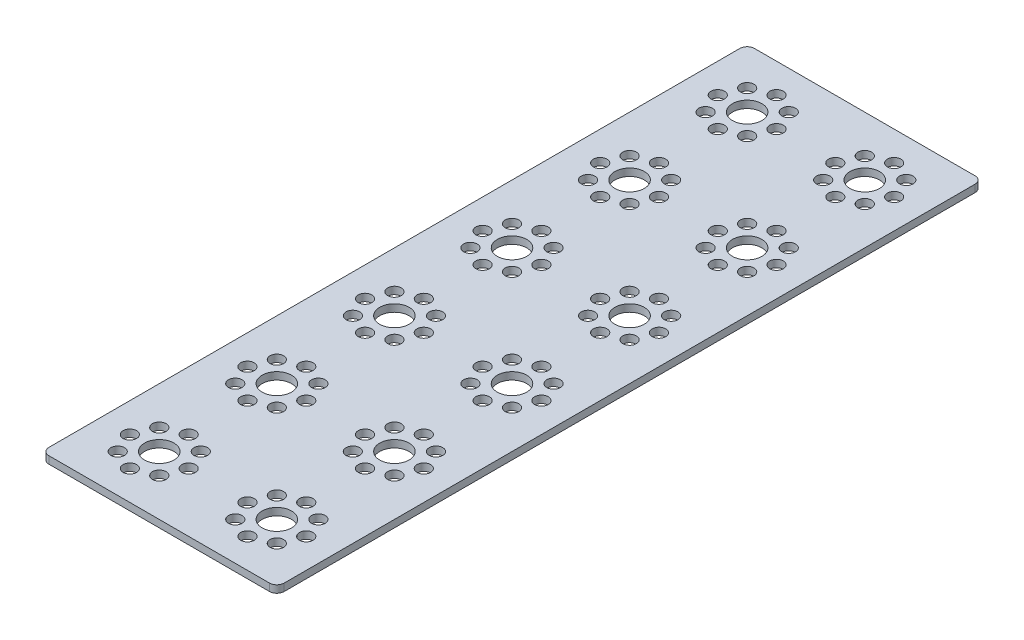
from build123d import *

# Parameters (mm, degrees)
SKETCH1_R           = 1.85
SKETCH1_R_2         = 4
BOSS_EXTRUDE1_DEPTH = 2


with BuildPart() as part:
    # Sketch1 → Boss-Extrude1 (new body)
    with BuildSketch(Plane.XZ):
        with BuildLine():
            Line((48, -174), (48, 14))
            ThreePointArc((48, 14), (47.414213562, 15.414213562), (46, 16))
            Line((46, 16), (-14, 16))
            ThreePointArc((-14, 16), (-15.414213562, 15.414213562), (-16, 14))
            Line((-16, 14), (-16, -174))
            ThreePointArc((-16, -174), (-15.414213562, -175.414213562), (-14, -176))
            Line((-14, -176), (46, -176))
            ThreePointArc((46, -176), (47.414213562, -175.414213562), (48, -174))
        make_face()
        with Locations(Location((37.656854249, -154.343145751, 0), (0, 0, 90))):
            Circle(SKETCH1_R, mode=Mode.SUBTRACT)
        with Locations(Location((26.343145751, -154.343145751, 0), (0, 0, 90))):
            Circle(SKETCH1_R, mode=Mode.SUBTRACT)
        with Locations(Location((26.343145751, -165.656854249, 0), (0, 0, 90))):
            Circle(SKETCH1_R, mode=Mode.SUBTRACT)
        with Locations(Location((37.656854249, -165.656854249, 0), (0, 0, 90))):
            Circle(SKETCH1_R, mode=Mode.SUBTRACT)
        with Locations(Location((24, -160, 0), (0, 0, 90))):
            Circle(SKETCH1_R, mode=Mode.SUBTRACT)
        with Locations(Location((32, -152, 0), (0, 0, 90))):
            Circle(SKETCH1_R, mode=Mode.SUBTRACT)
        with Locations(Location((40, -160, 0), (0, 0, 90))):
            Circle(SKETCH1_R, mode=Mode.SUBTRACT)
        with Locations(Location((32, -168, 0), (0, 0, 90))):
            Circle(SKETCH1_R, mode=Mode.SUBTRACT)
        with Locations(Location((32, -160, 0), (0, 0, 90))):
            Circle(SKETCH1_R_2, mode=Mode.SUBTRACT)
        with Locations(Location((5.656854249, -154.343145751, 0), (0, 0, 90))):
            Circle(SKETCH1_R, mode=Mode.SUBTRACT)
        with Locations(Location((-5.656854249, -154.343145751, 0), (0, 0, 90))):
            Circle(SKETCH1_R, mode=Mode.SUBTRACT)
        with Locations(Location((-5.656854249, -165.656854249, 0), (0, 0, 90))):
            Circle(SKETCH1_R, mode=Mode.SUBTRACT)
        with Locations(Location((5.656854249, -165.656854249, 0), (0, 0, 90))):
            Circle(SKETCH1_R, mode=Mode.SUBTRACT)
        with Locations(Location((-8, -160, 0), (0, 0, 90))):
            Circle(SKETCH1_R, mode=Mode.SUBTRACT)
        with Locations(Location((0, -152, 0), (0, 0, 90))):
            Circle(SKETCH1_R, mode=Mode.SUBTRACT)
        with Locations(Location((8, -160, 0), (0, 0, 90))):
            Circle(SKETCH1_R, mode=Mode.SUBTRACT)
        with Locations(Location((0, -168, 0), (0, 0, 90))):
            Circle(SKETCH1_R, mode=Mode.SUBTRACT)
        with Locations(Location((0, -160, 0), (0, 0, 90))):
            Circle(SKETCH1_R_2, mode=Mode.SUBTRACT)
        with Locations(Location((37.656854249, -122.34314575, 0), (0, 0, 90))):
            Circle(SKETCH1_R, mode=Mode.SUBTRACT)
        with Locations(Location((26.343145751, -122.34314575, 0), (0, 0, 90))):
            Circle(SKETCH1_R, mode=Mode.SUBTRACT)
        with Locations(Location((26.343145751, -133.656854249, 0), (0, 0, 90))):
            Circle(SKETCH1_R, mode=Mode.SUBTRACT)
        with Locations(Location((37.656854249, -133.656854249, 0), (0, 0, 90))):
            Circle(SKETCH1_R, mode=Mode.SUBTRACT)
        with Locations(Location((24, -128, 0), (0, 0, 90))):
            Circle(SKETCH1_R, mode=Mode.SUBTRACT)
        with Locations(Location((32, -120, 0), (0, 0, 90))):
            Circle(SKETCH1_R, mode=Mode.SUBTRACT)
        with Locations(Location((40, -128, 0), (0, 0, 90))):
            Circle(SKETCH1_R, mode=Mode.SUBTRACT)
        with Locations(Location((32, -136, 0), (0, 0, 90))):
            Circle(SKETCH1_R, mode=Mode.SUBTRACT)
        with Locations(Location((32, -128, 0), (0, 0, 90))):
            Circle(SKETCH1_R_2, mode=Mode.SUBTRACT)
        with Locations(Location((5.656854249, -122.34314575, 0), (0, 0, 90))):
            Circle(SKETCH1_R, mode=Mode.SUBTRACT)
        with Locations(Location((-5.656854249, -122.34314575, 0), (0, 0, 90))):
            Circle(SKETCH1_R, mode=Mode.SUBTRACT)
        with Locations(Location((-5.656854249, -133.656854249, 0), (0, 0, 90))):
            Circle(SKETCH1_R, mode=Mode.SUBTRACT)
        with Locations(Location((5.656854249, -133.656854249, 0), (0, 0, 90))):
            Circle(SKETCH1_R, mode=Mode.SUBTRACT)
        with Locations(Location((-8, -128, 0), (0, 0, 90))):
            Circle(SKETCH1_R, mode=Mode.SUBTRACT)
        with Locations(Location((0, -120, 0), (0, 0, 90))):
            Circle(SKETCH1_R, mode=Mode.SUBTRACT)
        with Locations(Location((8, -128, 0), (0, 0, 90))):
            Circle(SKETCH1_R, mode=Mode.SUBTRACT)
        with Locations(Location((0, -136, 0), (0, 0, 90))):
            Circle(SKETCH1_R, mode=Mode.SUBTRACT)
        with Locations(Location((0, -128, 0), (0, 0, 90))):
            Circle(SKETCH1_R_2, mode=Mode.SUBTRACT)
        with Locations(Location((37.656854249, -90.343145751, 0), (0, 0, 90))):
            Circle(SKETCH1_R, mode=Mode.SUBTRACT)
        with Locations(Location((26.343145751, -90.343145751, 0), (0, 0, 90))):
            Circle(SKETCH1_R, mode=Mode.SUBTRACT)
        with Locations(Location((26.343145751, -101.65685425, 0), (0, 0, 90))):
            Circle(SKETCH1_R, mode=Mode.SUBTRACT)
        with Locations(Location((37.656854249, -101.65685425, 0), (0, 0, 90))):
            Circle(SKETCH1_R, mode=Mode.SUBTRACT)
        with Locations(Location((24, -96, 0), (0, 0, 90))):
            Circle(SKETCH1_R, mode=Mode.SUBTRACT)
        with Locations(Location((32, -88, 0), (0, 0, 90))):
            Circle(SKETCH1_R, mode=Mode.SUBTRACT)
        with Locations(Location((40, -96, 0), (0, 0, 90))):
            Circle(SKETCH1_R, mode=Mode.SUBTRACT)
        with Locations(Location((32, -104, 0), (0, 0, 90))):
            Circle(SKETCH1_R, mode=Mode.SUBTRACT)
        with Locations(Location((32, -96, 0), (0, 0, 90))):
            Circle(SKETCH1_R_2, mode=Mode.SUBTRACT)
        with Locations(Location((5.656854249, -90.343145751, 0), (0, 0, 90))):
            Circle(SKETCH1_R, mode=Mode.SUBTRACT)
        with Locations(Location((-5.656854249, -90.343145751, 0), (0, 0, 90))):
            Circle(SKETCH1_R, mode=Mode.SUBTRACT)
        with Locations(Location((-5.656854249, -101.65685425, 0), (0, 0, 90))):
            Circle(SKETCH1_R, mode=Mode.SUBTRACT)
        with Locations(Location((5.656854249, -101.65685425, 0), (0, 0, 90))):
            Circle(SKETCH1_R, mode=Mode.SUBTRACT)
        with Locations(Location((-8, -96, 0), (0, 0, 90))):
            Circle(SKETCH1_R, mode=Mode.SUBTRACT)
        with Locations(Location((0, -88, 0), (0, 0, 90))):
            Circle(SKETCH1_R, mode=Mode.SUBTRACT)
        with Locations(Location((8, -96, 0), (0, 0, 90))):
            Circle(SKETCH1_R, mode=Mode.SUBTRACT)
        with Locations(Location((0, -104, 0), (0, 0, 90))):
            Circle(SKETCH1_R, mode=Mode.SUBTRACT)
        with Locations(Location((0, -96, 0), (0, 0, 90))):
            Circle(SKETCH1_R_2, mode=Mode.SUBTRACT)
        with Locations(Location((37.656854249, -58.343145751, 0), (0, 0, 90))):
            Circle(SKETCH1_R, mode=Mode.SUBTRACT)
        with Locations(Location((26.343145751, -58.343145751, 0), (0, 0, 90))):
            Circle(SKETCH1_R, mode=Mode.SUBTRACT)
        with Locations(Location((26.343145751, -69.656854249, 0), (0, 0, 90))):
            Circle(SKETCH1_R, mode=Mode.SUBTRACT)
        with Locations(Location((37.656854249, -69.656854249, 0), (0, 0, 90))):
            Circle(SKETCH1_R, mode=Mode.SUBTRACT)
        with Locations(Location((24, -64, 0), (0, 0, 90))):
            Circle(SKETCH1_R, mode=Mode.SUBTRACT)
        with Locations(Location((32, -56, 0), (0, 0, 90))):
            Circle(SKETCH1_R, mode=Mode.SUBTRACT)
        with Locations(Location((40, -64, 0), (0, 0, 90))):
            Circle(SKETCH1_R, mode=Mode.SUBTRACT)
        with Locations(Location((32, -72, 0), (0, 0, 90))):
            Circle(SKETCH1_R, mode=Mode.SUBTRACT)
        with Locations(Location((32, -64, 0), (0, 0, 90))):
            Circle(SKETCH1_R_2, mode=Mode.SUBTRACT)
        with Locations(Location((5.656854249, -58.343145751, 0), (0, 0, 90))):
            Circle(SKETCH1_R, mode=Mode.SUBTRACT)
        with Locations(Location((-5.656854249, -58.343145751, 0), (0, 0, 90))):
            Circle(SKETCH1_R, mode=Mode.SUBTRACT)
        with Locations(Location((-5.656854249, -69.656854249, 0), (0, 0, 90))):
            Circle(SKETCH1_R, mode=Mode.SUBTRACT)
        with Locations(Location((5.656854249, -69.656854249, 0), (0, 0, 90))):
            Circle(SKETCH1_R, mode=Mode.SUBTRACT)
        with Locations(Location((-8, -64, 0), (0, 0, 90))):
            Circle(SKETCH1_R, mode=Mode.SUBTRACT)
        with Locations(Location((0, -56, 0), (0, 0, 90))):
            Circle(SKETCH1_R, mode=Mode.SUBTRACT)
        with Locations(Location((8, -64, 0), (0, 0, 90))):
            Circle(SKETCH1_R, mode=Mode.SUBTRACT)
        with Locations(Location((0, -72, 0), (0, 0, 90))):
            Circle(SKETCH1_R, mode=Mode.SUBTRACT)
        with Locations(Location((0, -64, 0), (0, 0, 90))):
            Circle(SKETCH1_R_2, mode=Mode.SUBTRACT)
        with Locations(Location((0, 0, 0), (0, 0, 90))):
            Circle(SKETCH1_R_2, mode=Mode.SUBTRACT)
        with Locations(Location((37.656854249, -26.343145751, 0), (0, 0, 90))):
            Circle(SKETCH1_R, mode=Mode.SUBTRACT)
        with Locations(Location((26.343145751, -26.343145751, 0), (0, 0, 90))):
            Circle(SKETCH1_R, mode=Mode.SUBTRACT)
        with Locations(Location((26.343145751, -37.656854249, 0), (0, 0, 90))):
            Circle(SKETCH1_R, mode=Mode.SUBTRACT)
        with Locations(Location((37.656854249, -37.656854249, 0), (0, 0, 90))):
            Circle(SKETCH1_R, mode=Mode.SUBTRACT)
        with Locations(Location((24, -32, 0), (0, 0, 90))):
            Circle(SKETCH1_R, mode=Mode.SUBTRACT)
        with Locations(Location((32, -24, 0), (0, 0, 90))):
            Circle(SKETCH1_R, mode=Mode.SUBTRACT)
        with Locations(Location((40, -32, 0), (0, 0, 90))):
            Circle(SKETCH1_R, mode=Mode.SUBTRACT)
        with Locations(Location((32, -40, 0), (0, 0, 90))):
            Circle(SKETCH1_R, mode=Mode.SUBTRACT)
        with Locations(Location((32, -32, 0), (0, 0, 90))):
            Circle(SKETCH1_R_2, mode=Mode.SUBTRACT)
        with Locations(Location((5.656854249, -26.343145751, 0), (0, 0, 90))):
            Circle(SKETCH1_R, mode=Mode.SUBTRACT)
        with Locations(Location((-5.656854249, -26.343145751, 0), (0, 0, 90))):
            Circle(SKETCH1_R, mode=Mode.SUBTRACT)
        with Locations(Location((-5.656854249, -37.656854249, 0), (0, 0, 90))):
            Circle(SKETCH1_R, mode=Mode.SUBTRACT)
        with Locations(Location((5.656854249, -37.656854249, 0), (0, 0, 90))):
            Circle(SKETCH1_R, mode=Mode.SUBTRACT)
        with Locations(Location((-8, -32, 0), (0, 0, 90))):
            Circle(SKETCH1_R, mode=Mode.SUBTRACT)
        with Locations(Location((0, -24, 0), (0, 0, 90))):
            Circle(SKETCH1_R, mode=Mode.SUBTRACT)
        with Locations(Location((8, -32, 0), (0, 0, 90))):
            Circle(SKETCH1_R, mode=Mode.SUBTRACT)
        with Locations(Location((0, -40, 0), (0, 0, 90))):
            Circle(SKETCH1_R, mode=Mode.SUBTRACT)
        with Locations(Location((0, -32, 0), (0, 0, 90))):
            Circle(SKETCH1_R_2, mode=Mode.SUBTRACT)
        with Locations(Location((37.656854249, 5.656854249, 0), (0, 0, 90))):
            Circle(SKETCH1_R, mode=Mode.SUBTRACT)
        with Locations(Location((26.343145751, 5.656854249, 0), (0, 0, 90))):
            Circle(SKETCH1_R, mode=Mode.SUBTRACT)
        with Locations(Location((26.343145751, -5.656854249, 0), (0, 0, 90))):
            Circle(SKETCH1_R, mode=Mode.SUBTRACT)
        with Locations(Location((37.656854249, -5.656854249, 0), (0, 0, 90))):
            Circle(SKETCH1_R, mode=Mode.SUBTRACT)
        with Locations(Location((24, 0, 0), (0, 0, 90))):
            Circle(SKETCH1_R, mode=Mode.SUBTRACT)
        with Locations(Location((32, 8, 0), (0, 0, 90))):
            Circle(SKETCH1_R, mode=Mode.SUBTRACT)
        with Locations(Location((40, 0, 0), (0, 0, 90))):
            Circle(SKETCH1_R, mode=Mode.SUBTRACT)
        with Locations(Location((32, -8, 0), (0, 0, 90))):
            Circle(SKETCH1_R, mode=Mode.SUBTRACT)
        with Locations(Location((32, 0, 0), (0, 0, 90))):
            Circle(SKETCH1_R_2, mode=Mode.SUBTRACT)
        with Locations(Location((5.656854249, 5.656854249, 0), (0, 0, 90))):
            Circle(SKETCH1_R, mode=Mode.SUBTRACT)
        with Locations(Location((-5.656854249, 5.656854249, 0), (0, 0, 90))):
            Circle(SKETCH1_R, mode=Mode.SUBTRACT)
        with Locations(Location((-5.656854249, -5.656854249, 0), (0, 0, 90))):
            Circle(SKETCH1_R, mode=Mode.SUBTRACT)
        with Locations(Location((5.656854249, -5.656854249, 0), (0, 0, 90))):
            Circle(SKETCH1_R, mode=Mode.SUBTRACT)
        with Locations(Location((-8, 0, 0), (0, 0, 90))):
            Circle(SKETCH1_R, mode=Mode.SUBTRACT)
        with Locations(Location((0, 8, 0), (0, 0, 90))):
            Circle(SKETCH1_R, mode=Mode.SUBTRACT)
        with Locations(Location((8, 0, 0), (0, 0, 90))):
            Circle(SKETCH1_R, mode=Mode.SUBTRACT)
        with Locations(Location((0, -8, 0), (0, 0, 90))):
            Circle(SKETCH1_R, mode=Mode.SUBTRACT)
    extrude(amount=-BOSS_EXTRUDE1_DEPTH)


solid = part.part
